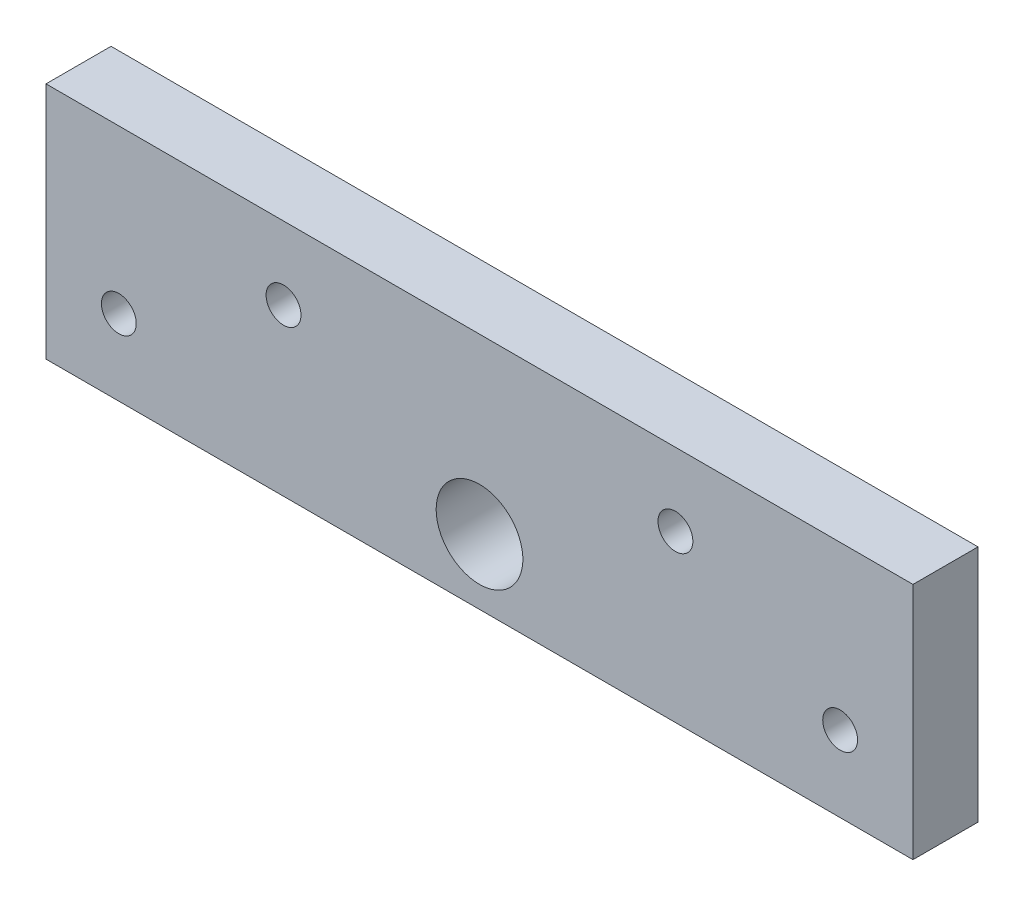
from build123d import *

# Parameters (mm, degrees)
SKETCH1_W                                    = 127
SKETCH1_H                                    = 34.925
SKETCH1_R                                    = 6.35
BOSS_EXTRUDE1_DEPTH                          = 9.525
CBORE_FOR_10_SOCKET_HEAD_CAP_SCREW1_AT_COUNT = 2
CBORE_FOR_10_SOCKET_HEAD_CAP_SCREW1_AT_PITCH = 27.477896212
CBORE_FOR_10_SOCKET_HEAD_CAP_SCREW1_2_COUNT  = 2
CBORE_FOR_10_SOCKET_HEAD_CAP_SCREW1_2_PITCH  = 57.404
CBORE_FOR_10_SOCKET_HEAD_CAP_SCREW1_3_COUNT  = 2
CBORE_FOR_10_SOCKET_HEAD_CAP_SCREW1_3_PITCH  = 82.586748551


with BuildPart() as part:
    # Sketch1 → Boss-Extrude1 (new body)
    with BuildSketch(Plane.XY):
        with Locations((0, 14.2875)):
            Rectangle(SKETCH1_W, SKETCH1_H)
        with Locations(Location((0, 6.35, 0), (0, 0, 180))):
            Circle(SKETCH1_R, mode=Mode.SUBTRACT)
    extrude(amount=BOSS_EXTRUDE1_DEPTH)

    # Sketch7 → CBORE for #10 Socket Head Cap Screw1 (revolve, cut)
    with BuildSketch(Plane(origin=(28.702, 21.082, 0), x_dir=(0, 1, 0), z_dir=(1, 0, 0))):
        Polygon((0, 0), (0, 9.525), (2.5527, 9.525), (2.5527, 4.826), (4.7625, 4.826), (4.7625, 0.635), (5.3975, 0), align=None)
    cbore_for_10_socket_head_cap_screw1 = revolve(axis=Axis((28.702, 21.082, -6.35), (0, 0, 1)), mode=Mode.SUBTRACT)

    # CBORE for #10 Socket Head Cap Screw1 at: CBORE for #10 Socket Head Cap Screw1 ×2
    with Locations(*[Vector(0.878160388030778, -0.47836631663781837, 0) * (i * CBORE_FOR_10_SOCKET_HEAD_CAP_SCREW1_AT_PITCH) for i in range(1, CBORE_FOR_10_SOCKET_HEAD_CAP_SCREW1_AT_COUNT)]):
        add(cbore_for_10_socket_head_cap_screw1, mode=Mode.SUBTRACT)

    # CBORE for _10 Socket Head Cap Screw1 2: CBORE for #10 Socket Head Cap Screw1 ×2
    with Locations(*[(-i * CBORE_FOR_10_SOCKET_HEAD_CAP_SCREW1_2_PITCH, 0, 0) for i in range(1, CBORE_FOR_10_SOCKET_HEAD_CAP_SCREW1_2_COUNT)]):
        add(cbore_for_10_socket_head_cap_screw1, mode=Mode.SUBTRACT)

    # CBORE for _10 Socket Head Cap Screw1 3: CBORE for #10 Socket Head Cap Screw1 ×2
    with Locations(*[Vector(-0.9872528151354362, -0.1591599164587503, 0) * (i * CBORE_FOR_10_SOCKET_HEAD_CAP_SCREW1_3_PITCH) for i in range(1, CBORE_FOR_10_SOCKET_HEAD_CAP_SCREW1_3_COUNT)]):
        add(cbore_for_10_socket_head_cap_screw1, mode=Mode.SUBTRACT)


solid = part.part
